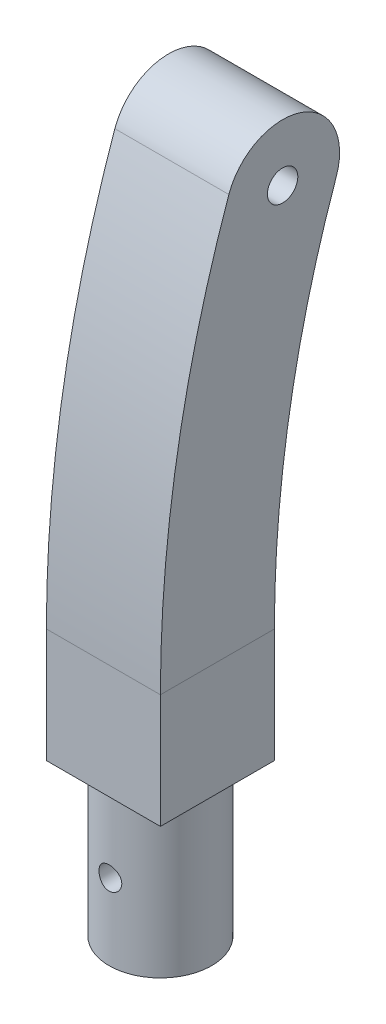
from build123d import *

# Parameters (mm, degrees)
SKETCH2_W           = 30
SKETCH2_H           = 30
SKETCH3_R           = 13.5
BOSS_EXTRUDE1_DEPTH = 40
BOSS_EXTRUDE2_DEPTH = 30
CUT_EXTRUDE1_REACH  = 153.523
SKETCH5_R           = 4
CUT_EXTRUDE2_REACH  = 155.212
SKETCH6_R           = 3


with BuildPart() as part:
    # Sweep1: sweep along a path in Sketch1
    with BuildLine(Plane(origin=(0, 0, 0), x_dir=(0, 0, -1), z_dir=(1, 0, 0))) as sweep1_path:
        Line((0, 0), (0, 30))
        ThreePointArc((0, 30), (4.320432104, 80.730593618), (17.157287525, 130))
    # Sketch2 → Sweep1 (sweep)
    with BuildSketch(Plane(origin=(0, 0, 0), x_dir=(1, 0, 0), z_dir=(0, 1, 0))):
        Rectangle(SKETCH2_W, SKETCH2_H)
    sweep(path=sweep1_path.line)

    # Sketch3 → Boss-Extrude1 (add)
    with BuildSketch(Plane.XZ):
        with Locations(Location((0, 0, 0), (0, 0, 270))):
            Circle(SKETCH3_R)
    extrude(amount=BOSS_EXTRUDE1_DEPTH)

    # Sketch4 → Boss-Extrude2 (add)
    with BuildSketch(Plane(origin=(15, 0, 0), x_dir=(0, 0, -1), z_dir=(1, 0, 0))):
        with BuildLine():
            Line((3.015151902, 135), (31.299423149, 125))
            ThreePointArc((31.299423149, 125), (22.157287525, 144.142135624), (3.015151902, 135))
        make_face()
    extrude(amount=-BOSS_EXTRUDE2_DEPTH)

    # Sketch5 → Cut-Extrude1 (cut, up to next)
    with BuildSketch(Plane(origin=(15, 0, 0), x_dir=(0, 0, -1), z_dir=(1, 0, 0)), mode=Mode.PRIVATE) as cut_extrude1_sk1:
        with Locations((17.157287525, 130)):
            Circle(SKETCH5_R)
    cut_extrude1_tool1 = extrude(cut_extrude1_sk1.sketch, amount=-CUT_EXTRUDE1_REACH, mode=Mode.PRIVATE) & part.part
    add(cut_extrude1_tool1.solids().sort_by_distance((15, 130, -17.157288))[0], mode=Mode.SUBTRACT)

    # Sketch6 → Cut-Extrude2 (cut, up to next)
    with BuildSketch(Plane.XY.offset(15), mode=Mode.PRIVATE) as cut_extrude2_sk1:
        with Locations((0, -20)):
            Circle(SKETCH6_R)
    cut_extrude2_tool1 = extrude(cut_extrude2_sk1.sketch, amount=-CUT_EXTRUDE2_REACH, mode=Mode.PRIVATE) & part.part
    add(cut_extrude2_tool1.solids().sort_by_distance((0, -20, 15))[0], mode=Mode.SUBTRACT)


solid = part.part
